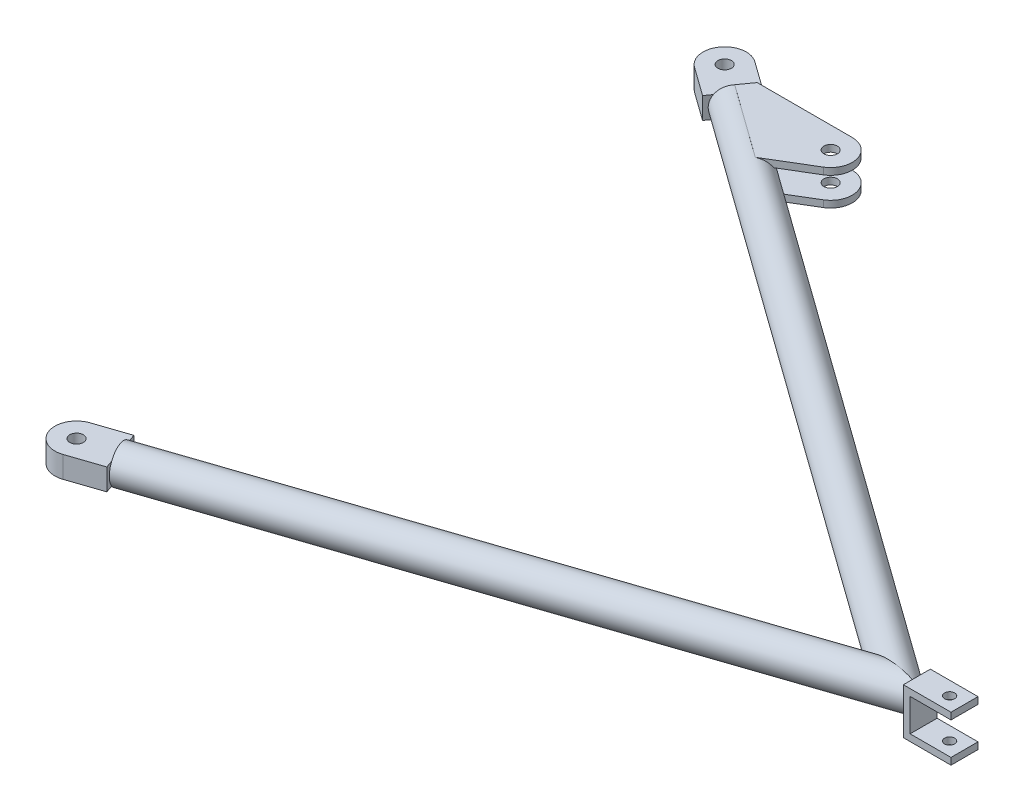
from build123d import *

# Parameters (mm, degrees)
SKETCH2_R                      = 8.255
BOSS_EXTRUDE1_DEPTH            = 8.89
BOSS_EXTRUDE1_DEPTH_BACK       = 3.81
BOSS_EXTRUDE2_DEPTH            = 10.16
BOSS_EXTRUDE2_DEPTH_BACK       = 16.256
SKETCH4_W                      = 20.32
SKETCH4_H                      = 10.16
BOSS_EXTRUDE3_DEPTH            = 10.16
BOSS_EXTRUDE3_DEPTH_BACK       = 16.51
SKETCH5_W                      = 20.32
SKETCH5_H                      = 10.16
CUT_EXTRUDE1_DEPTH             = 376.737208279
CUT_EXTRUDE2_DEPTH             = 373.322054439
CUT_EXTRUDE3_START             = -16.256
CUT_EXTRUDE3_DEPTH             = 16.256
CUT_EXTRUDE4_DEPTH             = 16.51
E_0_25_DIAMETER_HOLE1_D        = 6.35
E_0_25_DIAMETER_HOLE1_DEPTH    = 19.05
E_0_25_DIAMETER_HOLE1_TIP      = 1.907732465
F_3_16_0_1875_DIAMETER_HOLE1_D = 4.7625
CUT_EXTRUDE5_DEPTH             = 376.241596631
BOSS_EXTRUDE4_START            = 8.255
SKETCH15_R                     = 3.175
BOSS_EXTRUDE4_DEPTH            = 3.175
BOSS_EXTRUDE6_START            = -8.255
SKETCH16_R                     = 3.175
BOSS_EXTRUDE6_DEPTH            = 3.175


with BuildPart() as part:
    # Sweep1: sweep along a path in Sketch1
    with BuildLine(Plane(origin=(0, 0, 0), x_dir=(1, 0, 0), z_dir=(0, 1, 0))) as sweep1_path:
        Line((-288.830005751, -97.366666667), (0, 0))
        Line((0, 0), (-288.830005751, 207.433333333))
    # Sketch2 → Sweep1 (sweep)
    with BuildSketch(Plane(origin=(-288.830005751, 0, 97.366666667), x_dir=(-0.319444444444445, 0, -0.9476050057453159), z_dir=(0.9476050057453159, 0, -0.319444444444445))):
        Circle(SKETCH2_R)
    sweep(path=sweep1_path.line, transition=Transition.RIGHT)

    # Sketch3 → Boss-Extrude1 (add, two sides: drawn at the far end of the back side and taken through both)
    with BuildSketch(Plane.XY.offset(-BOSS_EXTRUDE1_DEPTH_BACK)):
        Polygon((33.931753368, 10.795), (11.535833333, 10.795), (11.535833333, -10.795), (33.931753368, -10.795), (33.931753368, -7.62), (14.710833333, -7.62), (14.710833333, 7.62), (33.931753368, 7.62), align=None)
    extrude(amount=BOSS_EXTRUDE1_DEPTH + BOSS_EXTRUDE1_DEPTH_BACK)

    # Sketch4 → Boss-Extrude2 (add, two sides: drawn at the far end of the back side and taken through both)
    with BuildSketch(Plane(origin=(-288.830005751, 0, 97.366666667), x_dir=(0.319444444444445, 0, 0.9476050057453159), z_dir=(-0.9476050057453159, 0, 0.319444444444445)).offset(-BOSS_EXTRUDE2_DEPTH_BACK)):
        Rectangle(SKETCH4_W, SKETCH4_H)
    extrude(amount=BOSS_EXTRUDE2_DEPTH + BOSS_EXTRUDE2_DEPTH_BACK)

    # Sketch5 → Boss-Extrude3 (add, two sides: drawn at the far end of the back side and taken through both)
    with BuildSketch(Plane(origin=(-288.830005751, 0, -207.433333333), x_dir=(-0.5833333333333331, 0, 0.8122328620674139), z_dir=(-0.8122328620674139, 0, -0.5833333333333331)).offset(-BOSS_EXTRUDE3_DEPTH_BACK)):
        Rectangle(SKETCH5_W, SKETCH5_H)
    extrude(amount=BOSS_EXTRUDE3_DEPTH + BOSS_EXTRUDE3_DEPTH_BACK)

    # Sketch6 → Cut-Extrude1 (cut, through all)
    with BuildSketch(Plane(origin=(0, 5.08, 0), x_dir=(1, 0, 0), z_dir=(0, 1, 0))):
        with BuildLine():
            Line((-294.756672418, 199.181047455), (-303.008958296, 205.107714121))
            Line((-303.008958296, 205.107714121), (-297.08229163, 213.36))
            ThreePointArc((-297.08229163, 213.36), (-298.856039246, 205.788872218), (-294.756672418, 199.181047455))
        make_face()
    cut_extrude1 = extrude(amount=-CUT_EXTRUDE1_DEPTH, mode=Mode.SUBTRACT)

    # Mirror1: Cut-Extrude1 across plane
    add(cut_extrude1.mirror(Plane(origin=(0, 0, 0), x_dir=(0.8122328620674136, 0, 0.5833333333333334), z_dir=(-0.583333333333333, 0, 0.8122328620674137))), mode=Mode.SUBTRACT)

    # Sketch7 → Cut-Extrude2 (cut, through all)
    with BuildSketch(Plane(origin=(0, 5.08, 0), x_dir=(1, 0, 0), z_dir=(0, 1, 0))):
        with BuildLine():
            Line((-285.584450196, -106.994333525), (-295.212117054, -110.239889081))
            Line((-295.212117054, -110.239889081), (-298.45767261, -100.612222222))
            ThreePointArc((-298.45767261, -100.612222222), (-293.342839932, -106.469409531), (-285.584450196, -106.994333525))
        make_face()
    cut_extrude2 = extrude(amount=-CUT_EXTRUDE2_DEPTH, mode=Mode.SUBTRACT)

    # Mirror2: Cut-Extrude2 across plane
    add(cut_extrude2.mirror(Plane(origin=(0, 0, 0), x_dir=(0.9476050057453158, 0, -0.3194444444444451), z_dir=(0.319444444444445, 0, 0.9476050057453159))), mode=Mode.SUBTRACT)

    # Sketch8 → Cut-Extrude3 (cut)
    with BuildSketch(Plane(origin=(-288.830005751, 0, 97.366666667), x_dir=(0.319444444444445, 0, 0.9476050057453159), z_dir=(-0.9476050057453159, 0, 0.319444444444445)).offset(CUT_EXTRUDE3_START)):
        with BuildLine():
            Line((6.506813736, -5.08), (-6.506813736, -5.08))
            ThreePointArc((-6.506813736, -5.08), (0, -8.255), (6.506813736, -5.08))
        make_face()
        with BuildLine():
            Line((-6.506813736, 5.08), (6.506813736, 5.08))
            ThreePointArc((6.506813736, 5.08), (0, 8.255), (-6.506813736, 5.08))
        make_face()
    extrude(amount=CUT_EXTRUDE3_DEPTH, mode=Mode.SUBTRACT)

    # Sketch9 → Cut-Extrude4 (cut)
    with BuildSketch(Plane(origin=(-288.830005751, 0, -207.433333333), x_dir=(-0.5833333333333331, 0, 0.8122328620674139), z_dir=(-0.8122328620674139, 0, -0.5833333333333331))):
        with BuildLine():
            Line((6.506813736, -5.08), (-6.506813736, -5.08))
            ThreePointArc((-6.506813736, -5.08), (0, -8.255), (6.506813736, -5.08))
        make_face()
        with BuildLine():
            Line((-6.506813736, 5.08), (6.506813736, 5.08))
            ThreePointArc((6.506813736, 5.08), (0, 8.255), (-6.506813736, 5.08))
        make_face()
    extrude(amount=-CUT_EXTRUDE4_DEPTH, mode=Mode.SUBTRACT)

    # E (0.25) Diameter Hole1
    with Locations(Plane(origin=(-288.830005751, 5.08, -207.433333333), x_dir=(0, 0, 1), z_dir=(0, 1, 0))):
        with Locations((0, 0), (304.8, 0)):
            Hole(E_0_25_DIAMETER_HOLE1_D / 2, depth=E_0_25_DIAMETER_HOLE1_DEPTH)
            with Locations((0, 0, -(E_0_25_DIAMETER_HOLE1_DEPTH + E_0_25_DIAMETER_HOLE1_TIP / 2))):  # 118° drill point
                Cone(0, E_0_25_DIAMETER_HOLE1_D / 2, E_0_25_DIAMETER_HOLE1_TIP, mode=Mode.SUBTRACT)

    # 3/16 (0.1875) Diameter Hole1 (through all)
    with Locations(Plane(origin=(0, 10.795, 0), x_dir=(1, 0, 0), z_dir=(0, 1, 0))):
        with Locations((26.933488785, -2.54)):
            Hole(F_3_16_0_1875_DIAMETER_HOLE1_D / 2)

    # Sketch14 → Cut-Extrude5 (cut, through all)
    with BuildSketch(Plane.XY.offset(8.89)):
        with BuildLine():
            Line((14.710833333, 4.695332569), (14.710833333, -4.695332569))
            add(Edge.make_bspline(
                [(14.710833333, -4.695332569), (21.746085132, 0), (14.710833333, 4.695332569)],
                knots=[5.678155611, 5.678155611, 5.678155611, 6.888215004, 6.888215004, 6.888215004], degree=2, weights=[1, 0.822485207, 1]))
        make_face()
    extrude(amount=-CUT_EXTRUDE5_DEPTH, mode=Mode.SUBTRACT)


with BuildPart() as body_2:
    # Sketch15 → Boss-Extrude4 (new body)
    with BuildSketch(Plane(origin=(0, 0, 0), x_dir=(1, 0, 0), z_dir=(0, 1, 0)).offset(BOSS_EXTRUDE4_START)):
        with BuildLine():
            Line((-225.900624532, 204.507482276), (-270.604624532, 204.507482276))
            Line((-270.604624532, 204.507482276), (-275.026418863, 198.350579421))
            Line((-275.026418863, 198.350579421), (-240.631954573, 173.648996365))
            Line((-240.631954573, 173.648996365), (-233.555101944, 177.899076585))
            Line((-233.555101944, 177.899076585), (-220.669756569, 185.637509811))
            ThreePointArc((-220.669756569, 185.637509811), (-216.109840083, 197.061545628), (-225.900624532, 204.507482276))
        make_face()
        with Locations(Location((-225.900624532, 194.347482276, 0), (0, 0, 270))):
            Circle(SKETCH15_R, mode=Mode.SUBTRACT)
    extrude(amount=-BOSS_EXTRUDE4_DEPTH)


with BuildPart() as body_3:
    # Sketch16 → Boss-Extrude6 (new body)
    with BuildSketch(Plane(origin=(0, 0, 0), x_dir=(1, 0, 0), z_dir=(0, 1, 0)).offset(BOSS_EXTRUDE6_START)):
        with BuildLine():
            Line((-270.604624532, 204.507482276), (-275.026418863, 198.350579421))
            Line((-275.026418863, 198.350579421), (-240.631954573, 173.648996365))
            Line((-240.631954573, 173.648996365), (-233.555101944, 177.899076585))
            Line((-233.555101944, 177.899076585), (-220.669756569, 185.637509811))
            ThreePointArc((-220.669756569, 185.637509811), (-216.109840083, 197.061545628), (-225.900624532, 204.507482276))
            Line((-225.900624532, 204.507482276), (-270.604624532, 204.507482276))
        make_face()
        with Locations(Location((-225.900624532, 194.347482276, 0), (0, 0, 270))):
            Circle(SKETCH16_R, mode=Mode.SUBTRACT)
    extrude(amount=BOSS_EXTRUDE6_DEPTH)


solid = Compound([part.part, body_2.part, body_3.part])
